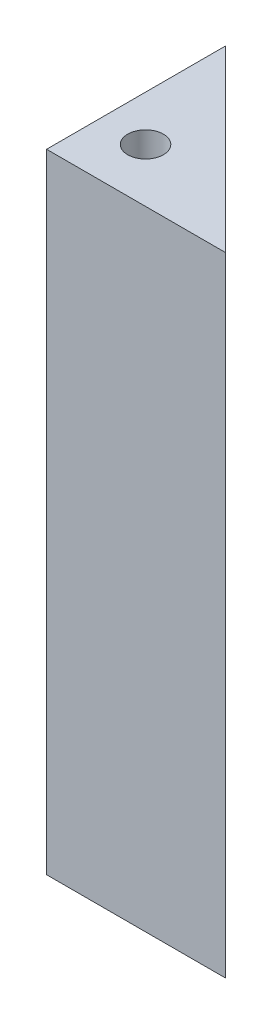
from build123d import *

# Parameters (mm, degrees)
SKETCH1_R           = 1.5
BOSS_EXTRUDE1_DEPTH = 5
BOSS_EXTRUDE2_DEPTH = 42.7
BOSS_EXTRUDE3_START = -47.7
SKETCH1_4_R         = 1.5
BOSS_EXTRUDE3_DEPTH = 5


with BuildPart() as part:
    # Sketch1 → Boss-Extrude1 (new body)
    with BuildSketch(Plane(origin=(0, 0, 0), x_dir=(1, 0, 0), z_dir=(0, 1, 0))):
        Polygon((0, 0), (0, -15), (15, -15), align=None)
        with Locations((3.8, -10.5)):
            Circle(SKETCH1_R, mode=Mode.SUBTRACT)
    extrude(amount=BOSS_EXTRUDE1_DEPTH)

    # Sketch1<2> → Boss-Extrude2 (add)
    with BuildSketch(Plane(origin=(0, 0, 0), x_dir=(1, 0, 0), z_dir=(0, 1, 0))):
        Polygon((15, -15), (0, 0), (0, -15), align=None)
    extrude(amount=-BOSS_EXTRUDE2_DEPTH)

    # Sketch1<4> → Boss-Extrude3 (add)
    with BuildSketch(Plane(origin=(0, 0, 0), x_dir=(1, 0, 0), z_dir=(0, 1, 0)).offset(BOSS_EXTRUDE3_START)):
        Polygon((15, -15), (0, 0), (0, -15), align=None)
        with Locations((3.8, -10.5)):
            Circle(SKETCH1_4_R, mode=Mode.SUBTRACT)
    extrude(amount=BOSS_EXTRUDE3_DEPTH)


solid = part.part
